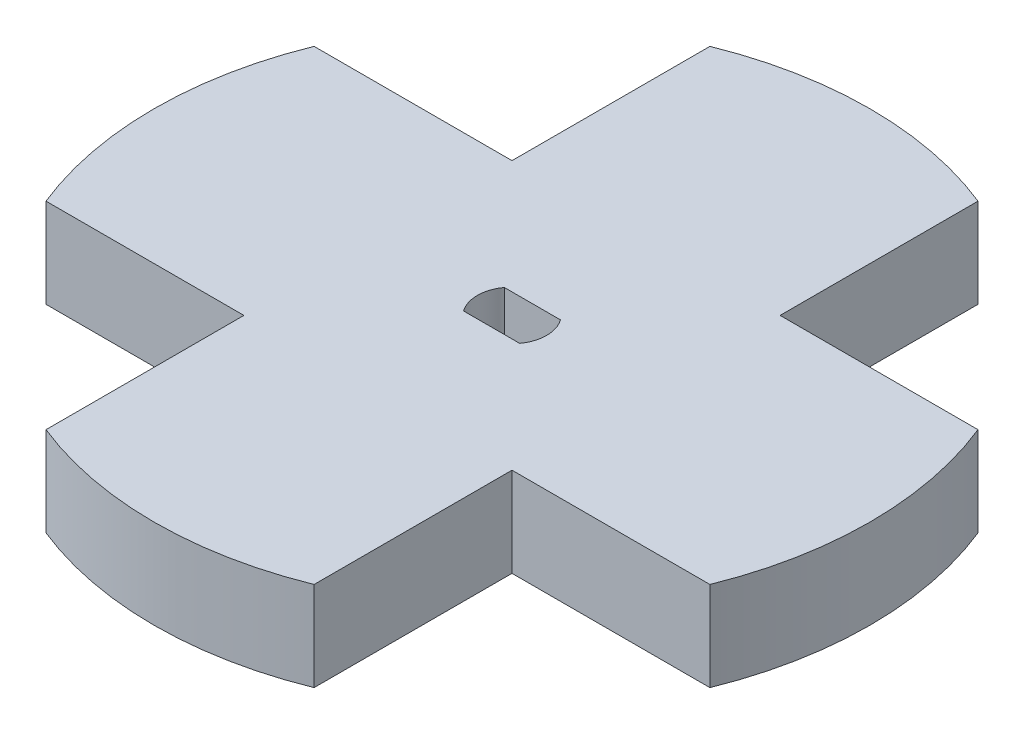
from build123d import *

# Parameters (mm, degrees)
BOSS_EXTRUDE1_DEPTH = 6.35


with BuildPart() as part:
    # Sketch1 → Boss-Extrude1 (new body)
    with BuildSketch(Plane(origin=(0, 0, 0), x_dir=(1, 0, 0), z_dir=(0, 1, 0))):
        with BuildLine():
            Line((2.128963531, 43.884099376), (2.128963531, 57.94662376))
            ThreePointArc((2.128963531, 57.94662376), (11.653963531, 59.797199376), (21.178963531, 57.94662376))
            Line((21.178963531, 57.94662376), (21.178963531, 43.884099376))
            Line((21.178963531, 43.884099376), (35.241487916, 43.884099376))
            ThreePointArc((35.241487916, 43.884099376), (37.092063531, 34.359099376), (35.241487916, 24.834099376))
            Line((35.241487916, 24.834099376), (21.178963531, 24.834099376))
            Line((21.178963531, 24.834099376), (21.178963531, 10.771574991))
            ThreePointArc((21.178963531, 10.771574991), (11.653963531, 8.920999376), (2.128963531, 10.771574991))
            Line((2.128963531, 10.771574991), (2.128963531, 24.834099376))
            Line((2.128963531, 24.834099376), (-11.933560854, 24.834099376))
            ThreePointArc((-11.933560854, 24.834099376), (-13.784136469, 34.359099376), (-11.933560854, 43.884099376))
            Line((-11.933560854, 43.884099376), (2.128963531, 43.884099376))
        make_face()
        with BuildLine():
            Line((11.653963531, 35.806899376), (13.647499485, 35.806899376))
            ThreePointArc((13.647499485, 35.806899376), (14.117763531, 34.359099376), (13.647499485, 32.911299376))
            Line((13.647499485, 32.911299376), (11.653963531, 32.911299376))
            Line((11.653963531, 32.911299376), (9.660427577, 32.911299376))
            ThreePointArc((9.660427577, 32.911299376), (9.190163531, 34.359099376), (9.660427577, 35.806899376))
            Line((9.660427577, 35.806899376), (11.653963531, 35.806899376))
        make_face(mode=Mode.SUBTRACT)
    extrude(amount=BOSS_EXTRUDE1_DEPTH)


solid = part.part
